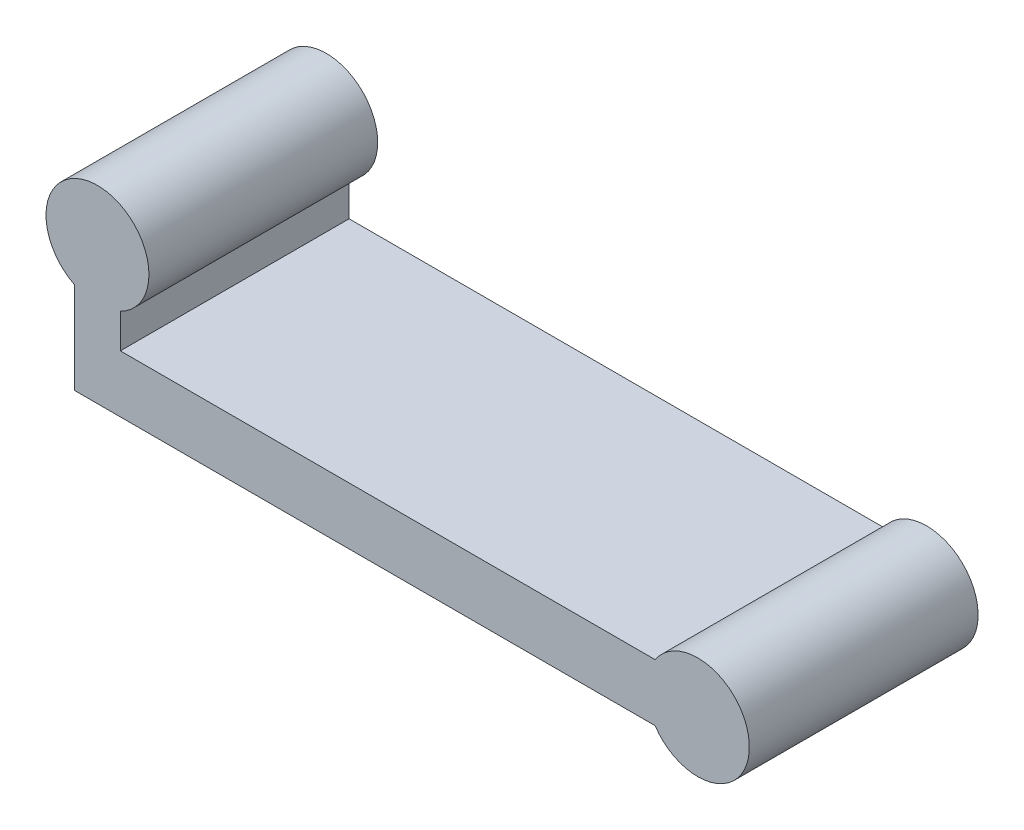
from build123d import *

# Parameters (mm, degrees)
BOSS_EXTRUDE1_DEPTH = 4


with BuildPart() as part:
    # Sketch1 → Boss-Extrude1 (new body)
    with BuildSketch(Plane.XY):
        with BuildLine():
            Line((0, 1.6), (0, 0))
            Line((0, 0), (10.15, 0))
            ThreePointArc((10.15, 0), (11.798331477, 0.5), (10.15, 1))
            Line((10.15, 1), (0.8, 1))
            Line((0.8, 1), (0.8, 1.6))
            ThreePointArc((0.8, 1.6), (0.4, 3.306225775), (0, 1.6))
        make_face()
    extrude(amount=BOSS_EXTRUDE1_DEPTH)


solid = part.part
